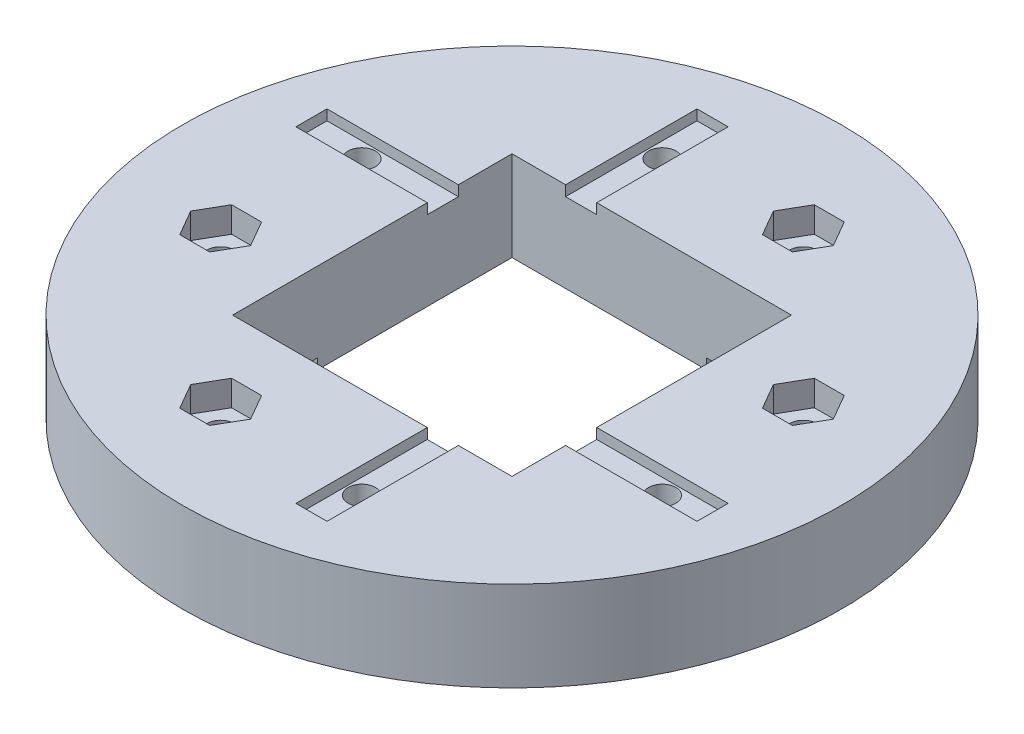
from build123d import *

# Parameters (mm, degrees)
SKETCH1_R           = 50.1
SKETCH1_W           = 40.4
SKETCH1_H           = 40.4
BOSS_EXTRUDE1_DEPTH = 13
SKETCH4_W           = 4.5
SKETCH4_H           = 19
SKETCH4_W_2         = 19
SKETCH4_H_2         = 4.5
CUT_EXTRUDE1_DEPTH  = 1.5
SKETCH5_W           = 4.5
SKETCH5_H           = 19
SKETCH5_W_2         = 19
SKETCH5_H_2         = 4.5
CUT_EXTRUDE2_DEPTH  = 1.5
SKETCH6_R           = 1.975
CUT_EXTRUDE3_DEPTH  = 21.5
SKETCH8_R           = 1.975
CUT_EXTRUDE4_DEPTH  = 21.5
CUT_EXTRUDE5_DEPTH  = 3.7
CUT_EXTRUDE6_DEPTH  = 3.7
CUT_EXTRUDE7_START  = -24
SKETCH11_R          = 50.1
SKETCH11_R_2        = 47.6
CUT_EXTRUDE7_DEPTH  = 24
SKETCH12_R          = 47.65
SKETCH12_R_2        = 47.6
BOSS_EXTRUDE2_DEPTH = 13


with BuildPart() as part:
    # Sketch1 → Boss-Extrude1 (new body)
    with BuildSketch(Plane(origin=(0, 0, 0), x_dir=(1, 0, 0), z_dir=(0, 1, 0))):
        with Locations(Location((0, 0, 0), (0, 0, 90))):
            Circle(SKETCH1_R)
        Rectangle(SKETCH1_W, SKETCH1_H, mode=Mode.SUBTRACT)
    extrude(amount=BOSS_EXTRUDE1_DEPTH)

    # Sketch4 → Cut-Extrude1 (cut)
    with BuildSketch(Plane(origin=(0, 13, 0), x_dir=(1, 0, 0), z_dir=(0, 1, 0))):
        with Locations((-10.2, 29.7)):
            Rectangle(SKETCH4_W, SKETCH4_H)
        with Locations((29.7, -10.2)):
            Rectangle(SKETCH4_W_2, SKETCH4_H_2)
        with Locations((10.2, -29.7)):
            Rectangle(SKETCH4_W, SKETCH4_H)
        with Locations((-29.7, 10.2)):
            Rectangle(SKETCH4_W_2, SKETCH4_H_2)
    extrude(amount=-CUT_EXTRUDE1_DEPTH, mode=Mode.SUBTRACT)

    # Sketch5 → Cut-Extrude2 (cut)
    with BuildSketch(Plane.XZ):
        with Locations((-10.2, 29.7)):
            Rectangle(SKETCH5_W, SKETCH5_H)
        with Locations((29.7, -10.2)):
            Rectangle(SKETCH5_W_2, SKETCH5_H_2)
        with Locations((10.2, -29.7)):
            Rectangle(SKETCH5_W, SKETCH5_H)
        with Locations((-29.7, 10.2)):
            Rectangle(SKETCH5_W_2, SKETCH5_H_2)
    extrude(amount=-CUT_EXTRUDE2_DEPTH, mode=Mode.SUBTRACT)

    # Sketch6 → Cut-Extrude3 (cut)
    with BuildSketch(Plane(origin=(0, 13, 0), x_dir=(1, 0, 0), z_dir=(0, 1, 0))):
        with Locations(Location((31.925, -10.2, 0), (0, 0, 270))):
            Circle(SKETCH6_R)
        with Locations(Location((-10.2, 31.925, 0), (0, 0, 270))):
            Circle(SKETCH6_R)
        with Locations(Location((-31.925, 10.2, 0), (0, 0, 270))):
            Circle(SKETCH6_R)
        with Locations(Location((10.2, -31.925, 0), (0, 0, 270))):
            Circle(SKETCH6_R)
    extrude(amount=-CUT_EXTRUDE3_DEPTH, mode=Mode.SUBTRACT)

    # Sketch8 → Cut-Extrude4 (cut)
    with BuildSketch(Plane.XZ):
        with Locations(Location((-10.2, 31.925, 0), (0, 0, 90))):
            Circle(SKETCH8_R)
        with Locations(Location((31.925, -10.2, 0), (0, 0, 270))):
            Circle(SKETCH8_R)
        with Locations(Location((10.2, -31.925, 0), (0, 0, 270))):
            Circle(SKETCH8_R)
        with Locations(Location((-31.925, 10.2, 0), (0, 0, 270))):
            Circle(SKETCH8_R)
    extrude(amount=-CUT_EXTRUDE4_DEPTH, mode=Mode.SUBTRACT)

    # Sketch9 → Cut-Extrude5 (cut)
    with BuildSketch(Plane.XZ):
        Polygon((14.530127019, 31.925), (12.365063509, 35.675), (8.034936491, 35.675), (5.869872981, 31.925), (8.034936491, 28.175), (12.365063509, 28.175), align=None)
        Polygon((36.255127019, 10.2), (34.090063509, 13.95), (29.759936491, 13.95), (27.594872981, 10.2), (29.759936491, 6.45), (34.090063509, 6.45), align=None)
        Polygon((-27.594872981, -10.2), (-29.759936491, -6.45), (-34.090063509, -6.45), (-36.255127019, -10.2), (-34.090063509, -13.95), (-29.759936491, -13.95), align=None)
        Polygon((-5.869872981, -31.925), (-8.034936491, -28.175), (-12.365063509, -28.175), (-14.530127019, -31.925), (-12.365063509, -35.675), (-8.034936491, -35.675), align=None)
    extrude(amount=-CUT_EXTRUDE5_DEPTH, mode=Mode.SUBTRACT)

    # Sketch10 → Cut-Extrude6 (cut)
    with BuildSketch(Plane(origin=(0, 13, 0), x_dir=(1, 0, 0), z_dir=(0, 1, 0))):
        Polygon((14.530127019, 31.925), (12.365063509, 35.675), (8.034936491, 35.675), (5.869872981, 31.925), (8.034936491, 28.175), (12.365063509, 28.175), align=None)
        Polygon((36.255127019, 10.2), (34.090063509, 13.95), (29.759936491, 13.95), (27.594872981, 10.2), (29.759936491, 6.45), (34.090063509, 6.45), align=None)
        Polygon((-5.869872981, -31.925), (-8.034936491, -28.175), (-12.365063509, -28.175), (-14.530127019, -31.925), (-12.365063509, -35.675), (-8.034936491, -35.675), align=None)
        Polygon((-27.594872981, -10.2), (-29.759936491, -6.45), (-34.090063509, -6.45), (-36.255127019, -10.2), (-34.090063509, -13.95), (-29.759936491, -13.95), align=None)
    extrude(amount=-CUT_EXTRUDE6_DEPTH, mode=Mode.SUBTRACT)

    # Sketch11 → Cut-Extrude7 (cut)
    with BuildSketch(Plane(origin=(0, 13, 0), x_dir=(1, 0, 0), z_dir=(0, 1, 0)).offset(CUT_EXTRUDE7_START)):
        Circle(SKETCH11_R)
        with Locations(Location((0, 0, 0), (0, 0, 270))):
            Circle(SKETCH11_R_2, mode=Mode.SUBTRACT)
    extrude(amount=CUT_EXTRUDE7_DEPTH, mode=Mode.SUBTRACT)

    # Sketch12 → Boss-Extrude2 (add)
    with BuildSketch(Plane.XZ):
        with Locations(Location((0, 0, 0), (0, 0, 270))):
            Circle(SKETCH12_R)
        Circle(SKETCH12_R_2, mode=Mode.SUBTRACT)
    extrude(amount=-BOSS_EXTRUDE2_DEPTH)


solid = part.part
